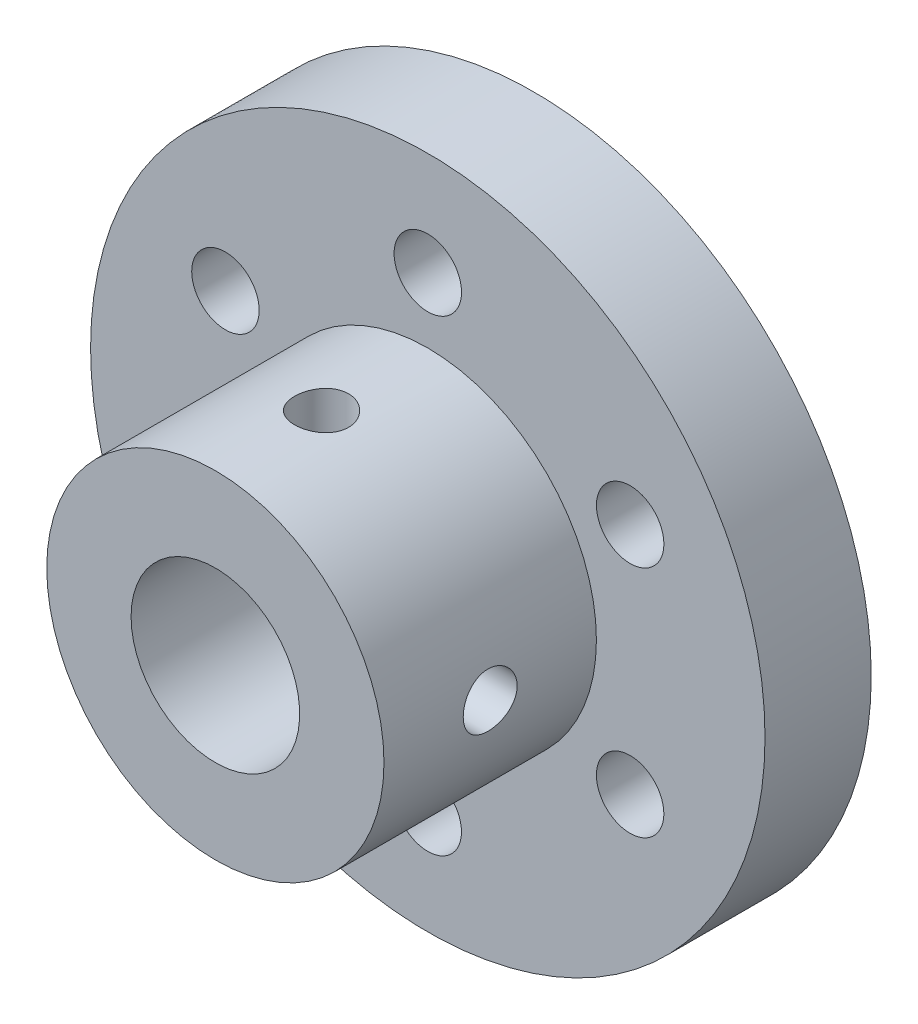
from build123d import *

# Parameters (mm, degrees)
SKETCH1_R           = 15.875
BOSS_EXTRUDE1_DEPTH = 15
SKETCH2_R           = 25.391657194
SKETCH2_R_2         = 7.9375
CUT_EXTRUDE1_DEPTH  = 10
SKETCH3_R           = 3.96875
CUT_EXTRUDE2_DEPTH  = 28.000578698
BOSS_EXTRUDE2_START = 3
SKETCH4_R           = 4.699
SKETCH4_R_2         = 3.96875
BOSS_EXTRUDE2_DEPTH = 3
SKETCH5_R           = 1.5875
CUT_EXTRUDE3_DEPTH  = 28.000578698
SKETCH6_R           = 1.27
CUT_EXTRUDE4_DEPTH  = 28.000578698
SKETCH7_R           = 1.27
CUT_EXTRUDE5_DEPTH  = 28.000578753


with BuildPart() as part:
    # Sketch1 → Boss-Extrude1 (new body)
    with BuildSketch(Plane.XY):
        Circle(SKETCH1_R)
    extrude(amount=BOSS_EXTRUDE1_DEPTH)

    # Sketch2 → Cut-Extrude1 (cut)
    with BuildSketch(Plane.XY.offset(15)):
        Circle(SKETCH2_R)
        Circle(SKETCH2_R_2, mode=Mode.SUBTRACT)
    extrude(amount=-CUT_EXTRUDE1_DEPTH, mode=Mode.SUBTRACT)

    # Sketch3 → Cut-Extrude2 (cut, through all)
    with BuildSketch(Plane(origin=(0, 0, 0), x_dir=(-1, 0, 0), z_dir=(0, 0, -1))):
        Circle(SKETCH3_R)
    extrude(amount=-CUT_EXTRUDE2_DEPTH, mode=Mode.SUBTRACT)

    # Sketch4 → Boss-Extrude2 (add)
    with BuildSketch(Plane(origin=(0, 0, 0), x_dir=(-1, 0, 0), z_dir=(0, 0, -1)).offset(BOSS_EXTRUDE2_START)):
        with Locations(Location((0, 0, 0), (0, 0, 180))):
            Circle(SKETCH4_R)
        Circle(SKETCH4_R_2, mode=Mode.SUBTRACT)
    extrude(amount=-BOSS_EXTRUDE2_DEPTH)

    # Sketch5 → Cut-Extrude3 (cut, through all)
    with BuildSketch(Plane(origin=(0, 0, 0), x_dir=(-1, 0, 0), z_dir=(0, 0, -1))):
        with Locations((0, 11)):
            Circle(SKETCH5_R)
        with Locations((9.526779442, 5.500866025)):
            Circle(SKETCH5_R)
        with Locations((9.527779442, -5.499133975)):
            Circle(SKETCH5_R)
        with Locations((0.002, -11)):
            Circle(SKETCH5_R)
        with Locations((-9.524779442, -5.500866025)):
            Circle(SKETCH5_R)
        with Locations((-9.525779442, 5.499133975)):
            Circle(SKETCH5_R)
    extrude(amount=-CUT_EXTRUDE3_DEPTH, mode=Mode.SUBTRACT)

    # Sketch6 → Cut-Extrude4 (cut, through all)
    with BuildSketch(Plane(origin=(0, 0, 0), x_dir=(1, 0, 0), z_dir=(0, 1, 0))):
        with Locations(Location((0, -10, 0), (0, 0, 90))):
            Circle(SKETCH6_R)
    extrude(amount=CUT_EXTRUDE4_DEPTH, mode=Mode.SUBTRACT)

    # Sketch7 → Cut-Extrude5 (cut, through all)
    with BuildSketch(Plane(origin=(0, 0, 0), x_dir=(0, 0, -1), z_dir=(1, 0, 0))):
        with Locations(Location((-10, 0, 0), (0, 0, 180))):
            Circle(SKETCH7_R)
    extrude(amount=CUT_EXTRUDE5_DEPTH, mode=Mode.SUBTRACT)


solid = part.part
